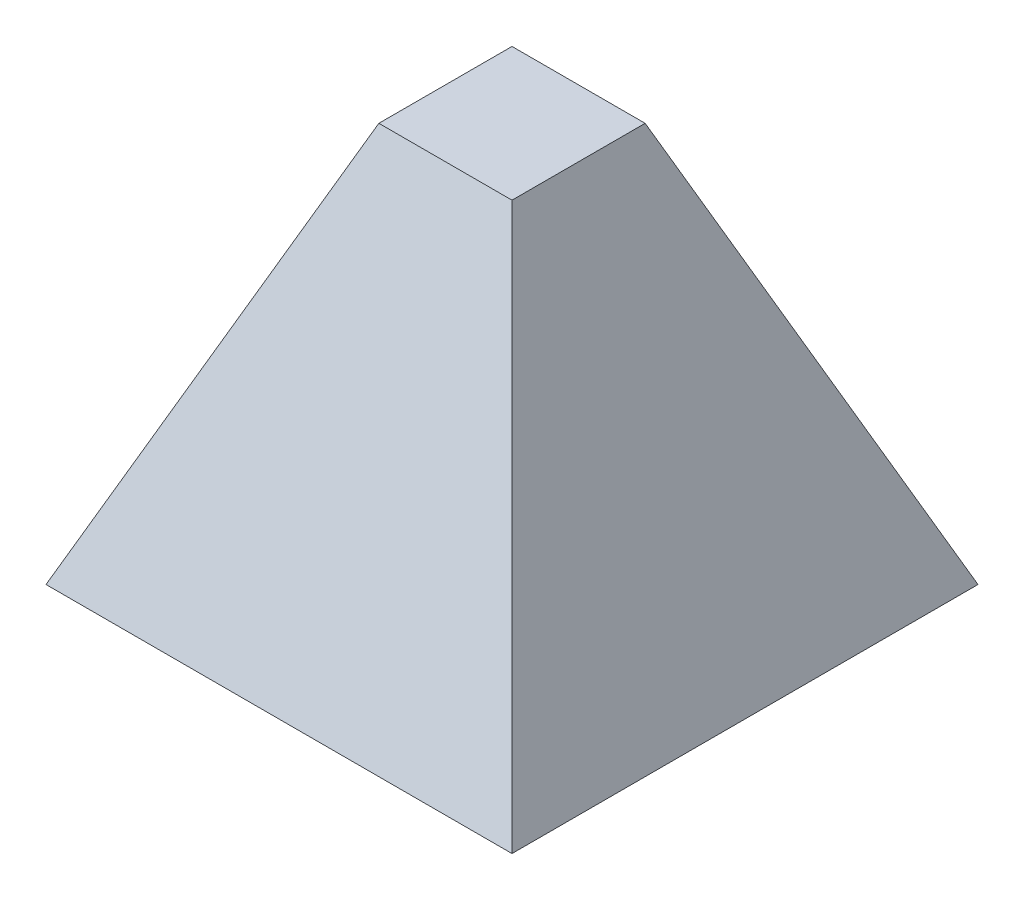
from build123d import *

# Parameters (mm, degrees)
SKETCH_1_W         = 140
SKETCH_1_H         = 140
EXTRUDE_1_DEPTH    = 120
EXTRUDE_1_TAPER    = 22.61986495
SHELL_1_T          = -3
SKETCH_000000000_W = 134
SKETCH_000000000_H = 134
EXTRUDE_2_DEPTH    = 10
EXTRUDE_2_TAPER    = 22.61986495


with BuildPart() as part:
    # 草图1 → 凸台-拉伸1 (new body)
    with BuildSketch(Plane(origin=(0, 0, 0), x_dir=(1, 0, 0), z_dir=(0, 1, 0))):
        Rectangle(SKETCH_1_W, SKETCH_1_H)
    extrude(amount=EXTRUDE_1_DEPTH, taper=EXTRUDE_1_TAPER)

    # 抽壳1
    shell_1_openings = [part.faces().sort_by_distance(p)[0] for p in [
        (0, 0, 0),
    ]]
    offset(amount=SHELL_1_T, openings=shell_1_openings, kind=Kind.INTERSECTION)


with BuildPart() as body_2:
    # 000000000 → 凸台-拉伸2 (new body)
    with BuildSketch(Plane(origin=(0, 0, 0), x_dir=(1, 0, 0), z_dir=(0, 1, 0))):
        Rectangle(SKETCH_000000000_W, SKETCH_000000000_H)
    extrude(amount=EXTRUDE_2_DEPTH, taper=EXTRUDE_2_TAPER)


solid = Compound([part.part, body_2.part])
